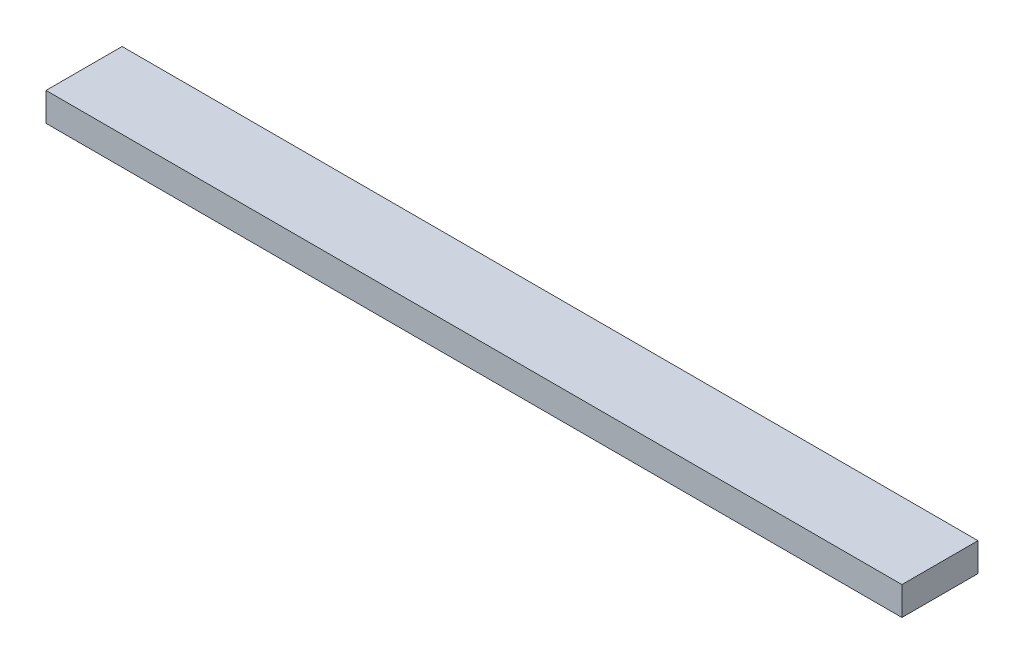
from build123d import *

# Parameters (mm, degrees)
SKETCH1_W           = 90
SKETCH1_H           = 8
BOSS_EXTRUDE1_DEPTH = 3


with BuildPart() as part:
    # Sketch1 → Boss-Extrude1 (new body)
    with BuildSketch(Plane(origin=(0, 0, 0), x_dir=(1, 0, 0), z_dir=(0, 1, 0))):
        with Locations((-54.78343949, 8.484076433)):
            Rectangle(SKETCH1_W, SKETCH1_H)
    extrude(amount=BOSS_EXTRUDE1_DEPTH)


solid = part.part
